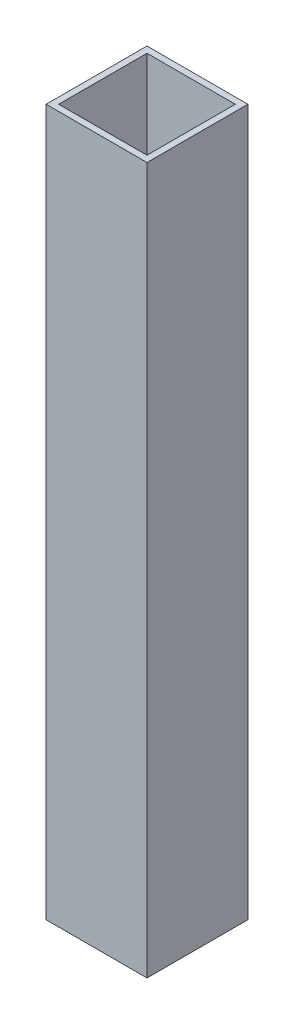
from build123d import *

# Parameters (mm, degrees)
SKETCH1_W           = 25.4
SKETCH1_H           = 25.4
SKETCH1_W_2         = 22.225
SKETCH1_H_2         = 22.225
BOSS_EXTRUDE1_DEPTH = 177.8


with BuildPart() as part:
    # Sketch1 → Boss-Extrude1 (new body)
    with BuildSketch(Plane(origin=(0, 0, 0), x_dir=(1, 0, 0), z_dir=(0, 1, 0))):
        Rectangle(SKETCH1_W, SKETCH1_H)
        Rectangle(SKETCH1_W_2, SKETCH1_H_2, mode=Mode.SUBTRACT)
    extrude(amount=BOSS_EXTRUDE1_DEPTH)


solid = part.part
